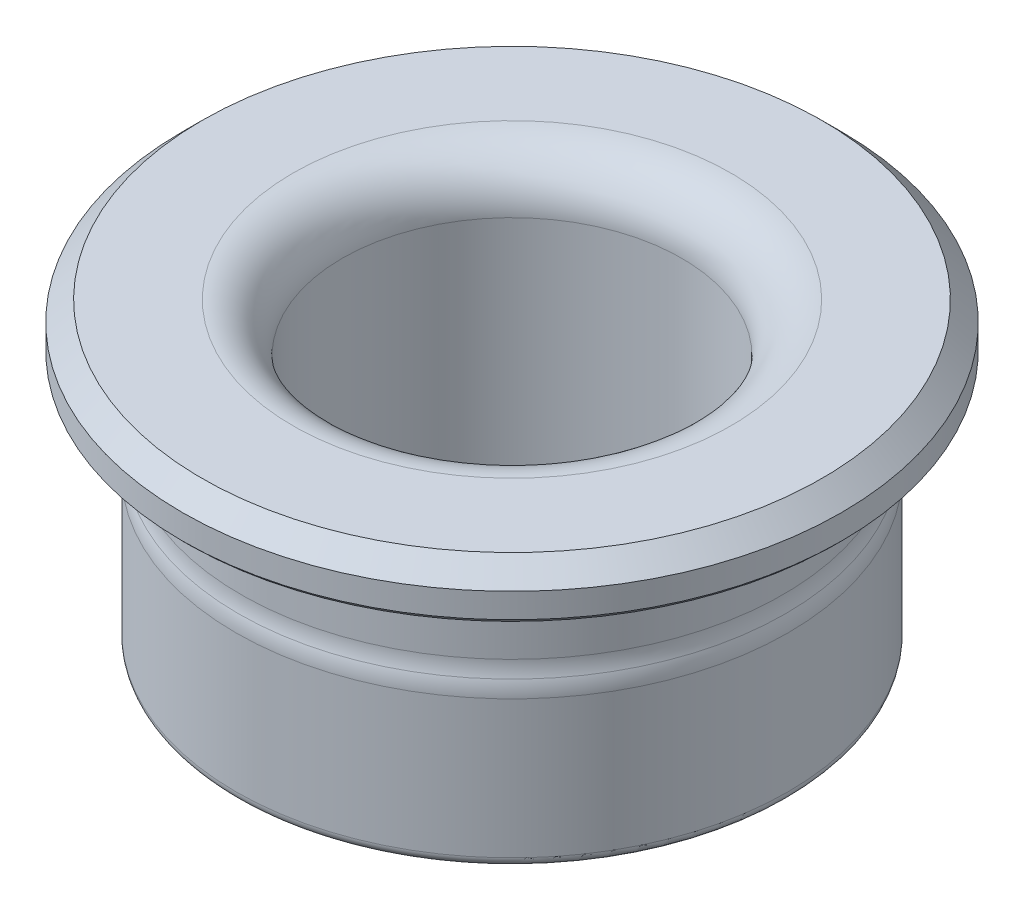
from build123d import *


with BuildPart() as part:
    # Sketch1 → Main Revolve (revolve)
    with BuildSketch(Plane.XY):
        with BuildLine():
            Line((-5.3, 0), (-3.65, 0))
            ThreePointArc((-3.65, 0), (-3.508578644, 0.058578644), (-3.45, 0.2))
            Line((-3.45, 0.2), (-3.45, 5.060607))
            ThreePointArc((-3.45, 5.060607), (-3.742893219, 5.767713781), (-4.45, 6.060607))
            Line((-4.45, 6.060607), (-6.3, 6.060607))
            Line((-6.3, 6.060607), (-6.7, 5.660607))
            Line((-6.7, 5.660607), (-6.7, 5.160607))
            Line((-6.7, 5.160607), (-6.6, 5.060607))
            Line((-6.6, 5.060607), (-5.81, 5.060607))
            ThreePointArc((-5.81, 5.060607), (-5.597867966, 4.972739034), (-5.51, 4.760607))
            Line((-5.51, 4.760607), (-5.51, 3.6214998))
            ThreePointArc((-5.51, 3.6214998), (-5.522579117, 3.463385917), (-5.56, 3.3092499))
            ThreePointArc((-5.56, 3.3092499), (-5.597420883, 3.155113883), (-5.61, 2.997))
            Line((-5.61, 2.997), (-5.61, 0.997))
            Line((-5.61, 0.997), (-5.61, 0.2))
            ThreePointArc((-5.61, 0.2), (-5.551421356, 0.058578644), (-5.41, 0))
            Line((-5.41, 0), (-5.3, 0))
        make_face()
    revolve(axis=Axis((0, 11.984375, 0), (0, -1, 0)))


solid = part.part
